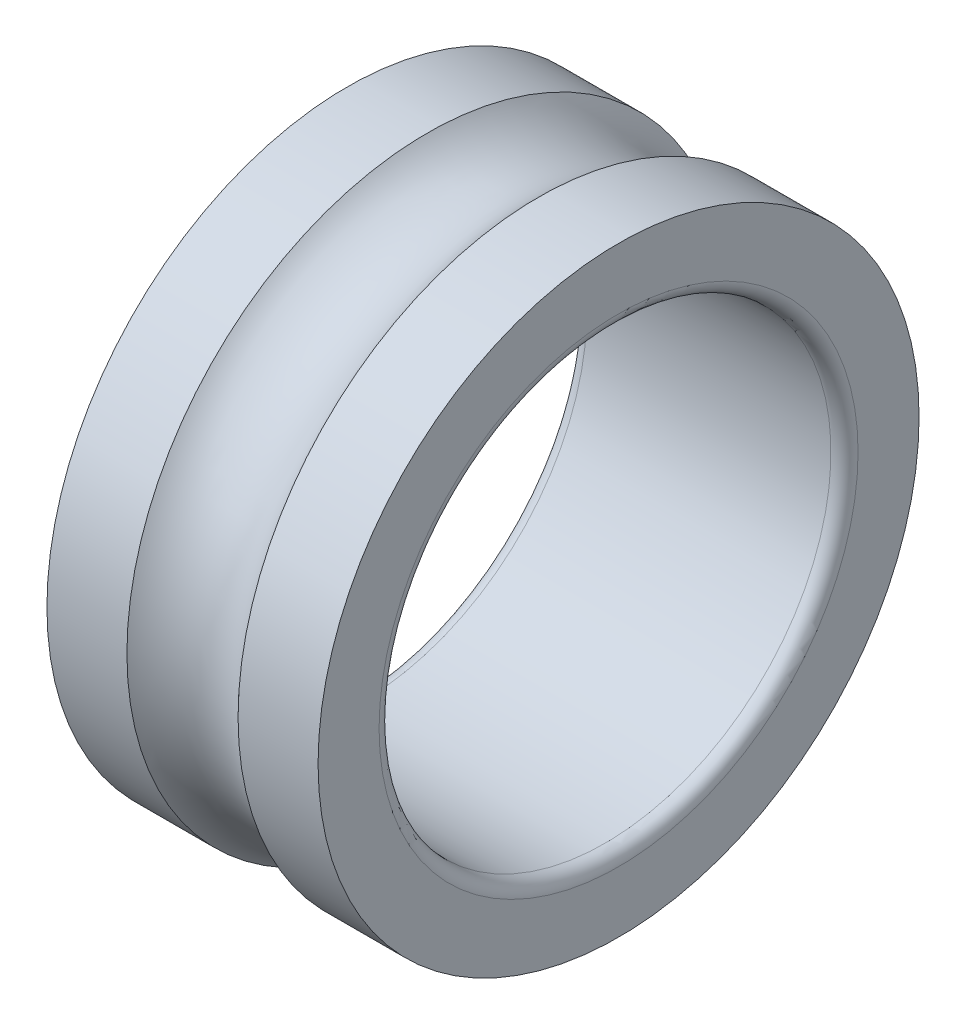
from build123d import *


with BuildPart() as part:
    # Esquisse1 → Base-Révolution (revolve)
    with BuildSketch(Plane(origin=(0, 0, 0), x_dir=(1, 0, 0), z_dir=(0, 1, 0))):
        with BuildLine():
            Line((0, 13.3), (0, 10.6))
            ThreePointArc((0, 10.6), (0.175735931, 10.175735931), (0.6, 10))
            Line((0.6, 10), (11.4, 10))
            ThreePointArc((11.4, 10), (11.824264069, 10.175735931), (12, 10.6))
            Line((12, 10.6), (12, 13.3))
            Line((12, 13.3), (8.459674775, 13.3))
            ThreePointArc((8.459674775, 13.3), (6, 12.2), (3.540325225, 13.3))
            Line((3.540325225, 13.3), (0, 13.3))
        make_face()
    revolve(axis=Axis((0, 0, 0), (1, 0, 0)))


solid = part.part
